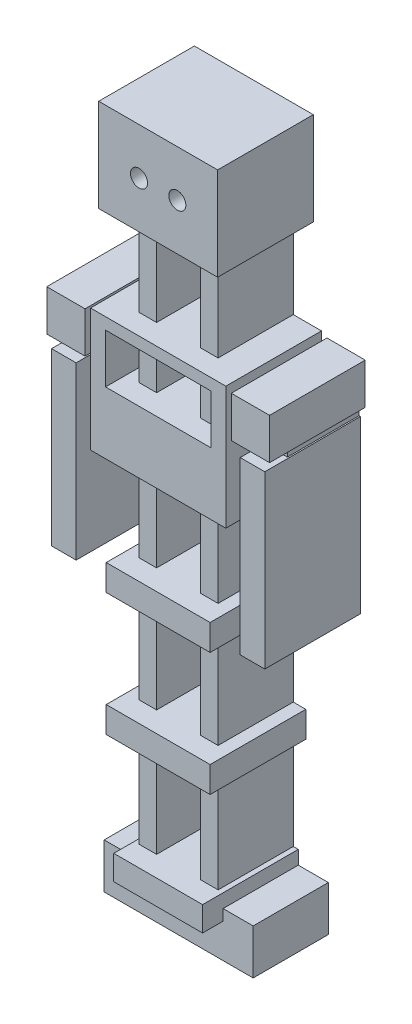
from build123d import *

# Parameters (mm, degrees)
SKETCH1_W             = 218
SKETCH1_H             = 66
BOSS_EXTRUDE1_DEPTH   = 110
SKETCH1_W_2           = 25.4
SKETCH1_H_2           = 820
BOSS_EXTRUDE1_2_DEPTH = 110
BOSS_EXTRUDE1_3_DEPTH = 110
SKETCH2_W             = 130
SKETCH2_H             = 36
SKETCH2_W_2           = 152
SKETCH2_H_2           = 38
SKETCH2_W_3           = 198
SKETCH2_H_3           = 180
SKETCH2_W_4           = 154
SKETCH2_H_4           = 72
SKETCH2_W_5           = 56
SKETCH2_H_5           = 60
SKETCH2_W_6           = 36
SKETCH2_H_6           = 250
SKETCH2_W_7           = 174
SKETCH2_H_7           = 136
SKETCH2_R             = 12.5
BOSS_EXTRUDE2_DEPTH   = 140
SKETCH3_W             = 24
SKETCH3_H             = 44
SKETCH3_W_2           = 32
SKETCH3_H_2           = 30
SKETCH3_W_3           = 116
SKETCH3_H_3           = 36
BOSS_EXTRUDE3_DEPTH   = 105


with BuildPart() as part:
    # Sketch1 → Boss-Extrude1 (new body)
    with BuildSketch(Plane.XY):
        with Locations((0, 33)):
            Rectangle(SKETCH1_W, SKETCH1_H)
    extrude(amount=BOSS_EXTRUDE1_DEPTH)



with BuildPart() as body_2:
    # Sketch1 → Boss-Extrude1 2 (new body)
    with BuildSketch(Plane.XY):
        with Locations((-45, 485)):
            Rectangle(SKETCH1_W_2, SKETCH1_H_2)
    extrude(amount=BOSS_EXTRUDE1_2_DEPTH)


with BuildPart() as body_3:
    # Sketch1 → Boss-Extrude1 3 (new body)
    with BuildSketch(Plane.XY):
        with Locations((45, 485)):
            Rectangle(SKETCH1_W_2, SKETCH1_H_2)
    extrude(amount=BOSS_EXTRUDE1_3_DEPTH)


with BuildPart() as part_1:
    add(part.part)

    add(body_2.part)  # Boss-Extrude2 merges body 2

    add(body_3.part)  # Boss-Extrude2 merges body 3
    # Sketch2 → Boss-Extrude2 (add)
    # profile 1 of 9: a face of its own
    with BuildSketch(Plane.XY):
        with Locations((0, 68)):
            Rectangle(SKETCH2_W, SKETCH2_H)
    # profile 2 of 9: a face of its own
    with BuildSketch(Plane.XY):
        with Locations((0, 250)):
            Rectangle(SKETCH2_W_2, SKETCH2_H_2)
    # profile 3 of 9: a face of its own
    with BuildSketch(Plane.XY):
        with Locations((0, 430)):
            Rectangle(SKETCH2_W_2, SKETCH2_H_2)
    # profile 4 of 9: a face of its own
    with BuildSketch(Plane.XY):
        with Locations((0, 670)):
            Rectangle(SKETCH2_W_3, SKETCH2_H_3)
        with Locations((0, 707)):
            Rectangle(SKETCH2_W_4, SKETCH2_H_4, mode=Mode.SUBTRACT)
    # profile 5 of 9: a face of its own
    with BuildSketch(Plane.XY):
        with Locations((-135, 725)):
            Rectangle(SKETCH2_W_5, SKETCH2_H_5)
    # profile 6 of 9: a face of its own
    with BuildSketch(Plane.XY):
        with Locations((135, 725)):
            Rectangle(SKETCH2_W_5, SKETCH2_H_5)
    # profile 7 of 9: a face of its own
    with BuildSketch(Plane.XY):
        with Locations((-138, 555)):
            Rectangle(SKETCH2_W_6, SKETCH2_H_6)
    # profile 8 of 9: a face of its own
    with BuildSketch(Plane.XY):
        with Locations((138, 555)):
            Rectangle(SKETCH2_W_6, SKETCH2_H_6)
    # profile 9 of 9: a face of its own
    with BuildSketch(Plane.XY):
        with Locations((0, 960)):
            Rectangle(SKETCH2_W_7, SKETCH2_H_7)
        with Locations((-28, 960)):
            Circle(SKETCH2_R, mode=Mode.SUBTRACT)
        with Locations((28, 960)):
            Circle(SKETCH2_R, mode=Mode.SUBTRACT)
    extrude(amount=BOSS_EXTRUDE2_DEPTH)

    # Sketch3 → Boss-Extrude3 (add)
    with BuildSketch(Plane.XY):
        with Locations((-103, 725)):
            Rectangle(SKETCH3_W, SKETCH3_H)
        with Locations((103, 725)):
            Rectangle(SKETCH3_W, SKETCH3_H)
        with Locations((-138, 688)):
            Rectangle(SKETCH3_W_2, SKETCH3_H_2)
        with Locations((138, 688)):
            Rectangle(SKETCH3_W_2, SKETCH3_H_2)
        with Locations((0, 885)):
            Rectangle(SKETCH3_W_3, SKETCH3_H_3)
    extrude(amount=BOSS_EXTRUDE3_DEPTH)


solid = part_1.part
